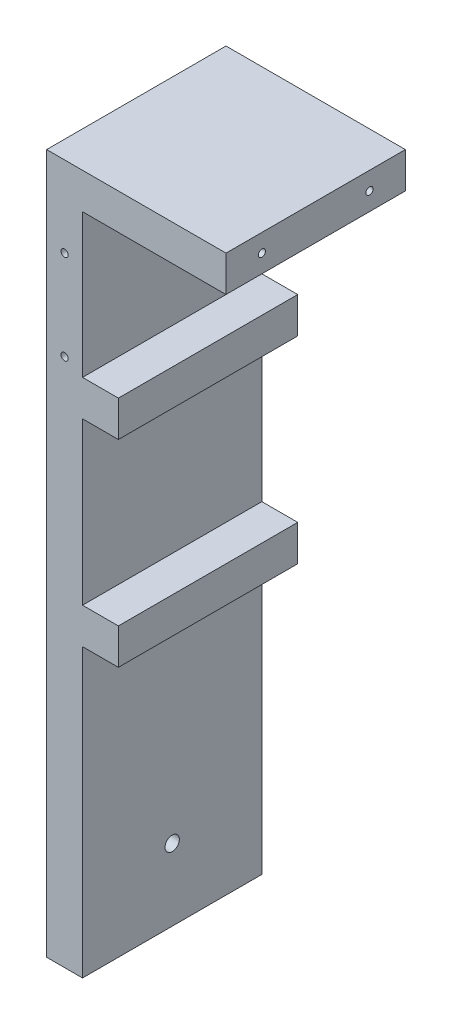
from build123d import *

# Parameters (mm, degrees)
SKIZZE1_W                       = 50
SKIZZE1_H                       = 185
AUFSATZ_LINEAR_AUSTRAGEN1_DEPTH = 10
SKIZZE3_W                       = 10
SKIZZE3_H                       = 10
AUFSATZ_LINEAR_AUSTRAGEN3_DEPTH = 50
SKIZZE4_R                       = 2
SCHNITT_LINEAR_AUSTRAGEN1_DEPTH = 97.33924434
SKIZZE6_W                       = 50
SKIZZE6_H                       = 50
AUFSATZ_LINEAR_AUSTRAGEN4_DEPTH = 10
SKIZZE7_R                       = 1
SCHNITT_LINEAR_AUSTRAGEN2_DEPTH = 125.524094054
SKIZZE8_R                       = 1
SCHNITT_LINEAR_AUSTRAGEN3_DEPTH = 10


with BuildPart() as part:
    # Skizze1 → Aufsatz-Linear austragen1 (new body)
    with BuildSketch(Plane(origin=(0, 0, 0), x_dir=(0, 0, -1), z_dir=(1, 0, 0))):
        Rectangle(SKIZZE1_W, SKIZZE1_H)
    extrude(amount=AUFSATZ_LINEAR_AUSTRAGEN1_DEPTH)

    # Skizze3 → Aufsatz-Linear austragen3 (add)
    with BuildSketch(Plane.XY.offset(25)):
        with Locations((15, 47.5)):
            Rectangle(SKIZZE3_W, SKIZZE3_H)
        with Locations((15, -7.5)):
            Rectangle(SKIZZE3_W, SKIZZE3_H)
    extrude(amount=-AUFSATZ_LINEAR_AUSTRAGEN3_DEPTH)

    # Skizze4 → Schnitt-Linear austragen1 (cut, through all)
    with BuildSketch(Plane(origin=(10, 0, 0), x_dir=(0, 0, -1), z_dir=(1, 0, 0))):
        with Locations((0, -72.5)):
            Circle(SKIZZE4_R)
    extrude(amount=-SCHNITT_LINEAR_AUSTRAGEN1_DEPTH, mode=Mode.SUBTRACT)

    # Skizze6 → Aufsatz-Linear austragen4 (add)
    with BuildSketch(Plane(origin=(0, 92.5, 0), x_dir=(1, 0, 0), z_dir=(0, 1, 0))):
        with Locations((25, 0)):
            Rectangle(SKIZZE6_W, SKIZZE6_H)
    extrude(amount=AUFSATZ_LINEAR_AUSTRAGEN4_DEPTH)

    # Skizze7 → Schnitt-Linear austragen2 (cut, through all)
    with BuildSketch(Plane.XY.offset(25)):
        with Locations((5, 80)):
            Circle(SKIZZE7_R)
        with Locations((5, 55)):
            Circle(SKIZZE7_R)
    extrude(amount=-SCHNITT_LINEAR_AUSTRAGEN2_DEPTH, mode=Mode.SUBTRACT)

    # Skizze8 → Schnitt-Linear austragen3 (cut)
    with BuildSketch(Plane(origin=(50, 0, 0), x_dir=(0, 0, -1), z_dir=(1, 0, 0))):
        with Locations((-15, 97.5)):
            Circle(SKIZZE8_R)
        with Locations((15, 97.5)):
            Circle(SKIZZE8_R)
    extrude(amount=-SCHNITT_LINEAR_AUSTRAGEN3_DEPTH, mode=Mode.SUBTRACT)


solid = part.part
